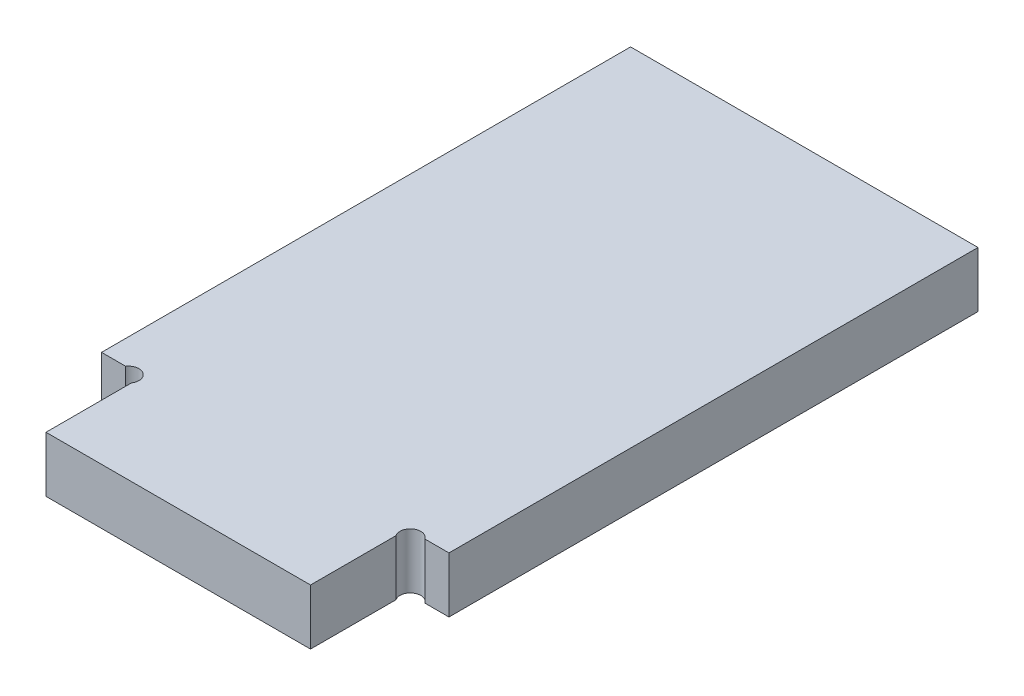
from build123d import *

# Parameters (mm, degrees)
BOSS_EXTRUDE1_DEPTH = 0.4


with BuildPart() as part:
    # Sketch1 → Boss-Extrude1 (new, symmetric)
    with BuildSketch(Plane(origin=(0, 0, 0), x_dir=(1, 0, 0), z_dir=(0, 1, 0))):
        with BuildLine():
            Line((-1.905, -0.167031015), (-1.905, -1.397))
            Line((-1.905, -1.397), (1.905, -1.397))
            Line((1.905, -1.397), (1.905, -0.167031015))
            ThreePointArc((1.905, -0.167031015), (1.946084492, 0.041084492), (2.1542, 0))
            Line((2.1542, 0), (2.5019, 0))
            Line((2.5019, 0), (2.5019, 7.62))
            Line((2.5019, 7.62), (-2.5019, 7.62))
            Line((-2.5019, 7.62), (-2.5019, 0))
            Line((-2.5019, 0), (-2.1542, 0))
            ThreePointArc((-2.1542, 0), (-1.946084492, 0.041084492), (-1.905, -0.167031015))
        make_face()
    extrude(amount=BOSS_EXTRUDE1_DEPTH, both=True)


solid = part.part
